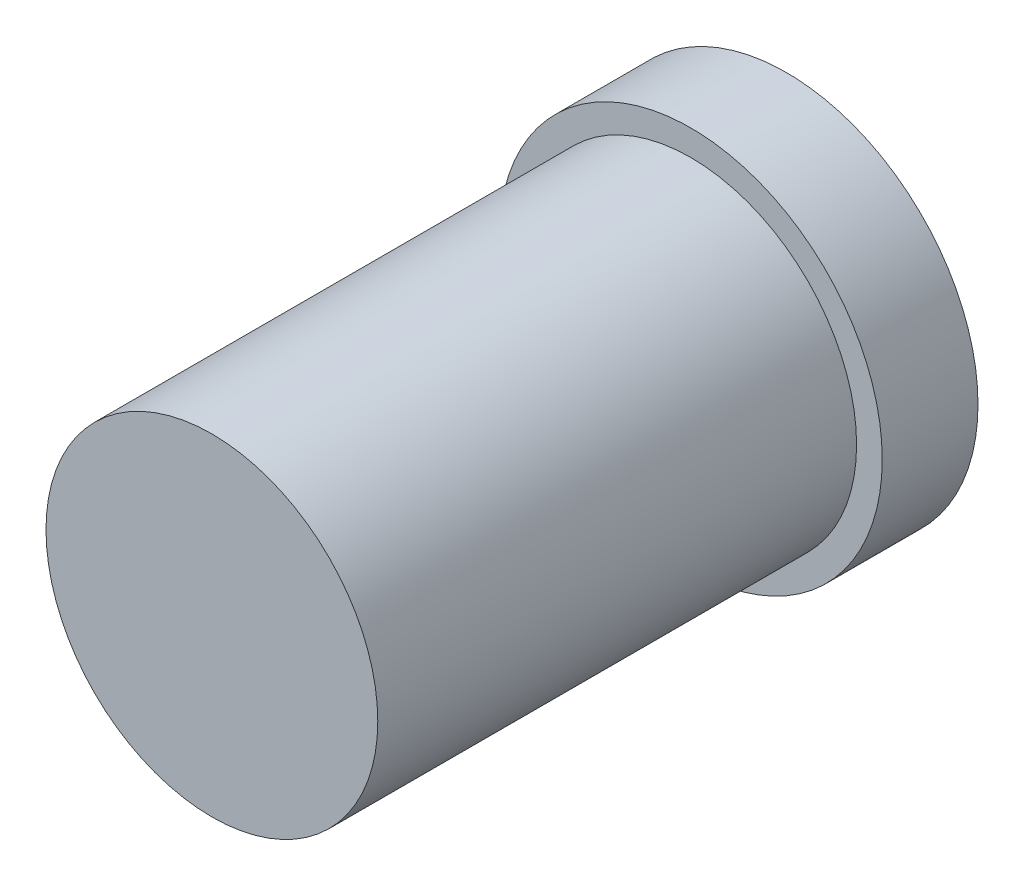
from build123d import *

# Parameters (mm, degrees)
SKETCH1_R           = 82.4992
BOSS_EXTRUDE1_DEPTH = 285.75
SKETCH2_R           = 95.25
BOSS_EXTRUDE2_DEPTH = 47.625


with BuildPart() as part:
    # Sketch1 → Boss-Extrude1 (new body)
    with BuildSketch(Plane.XY):
        Circle(SKETCH1_R)
    extrude(amount=-BOSS_EXTRUDE1_DEPTH)

    # Sketch2 → Boss-Extrude2 (add)
    with BuildSketch(Plane(origin=(0, 0, -285.75), x_dir=(-1, 0, 0), z_dir=(0, 0, -1))):
        Circle(SKETCH2_R)
    extrude(amount=-BOSS_EXTRUDE2_DEPTH)


solid = part.part
